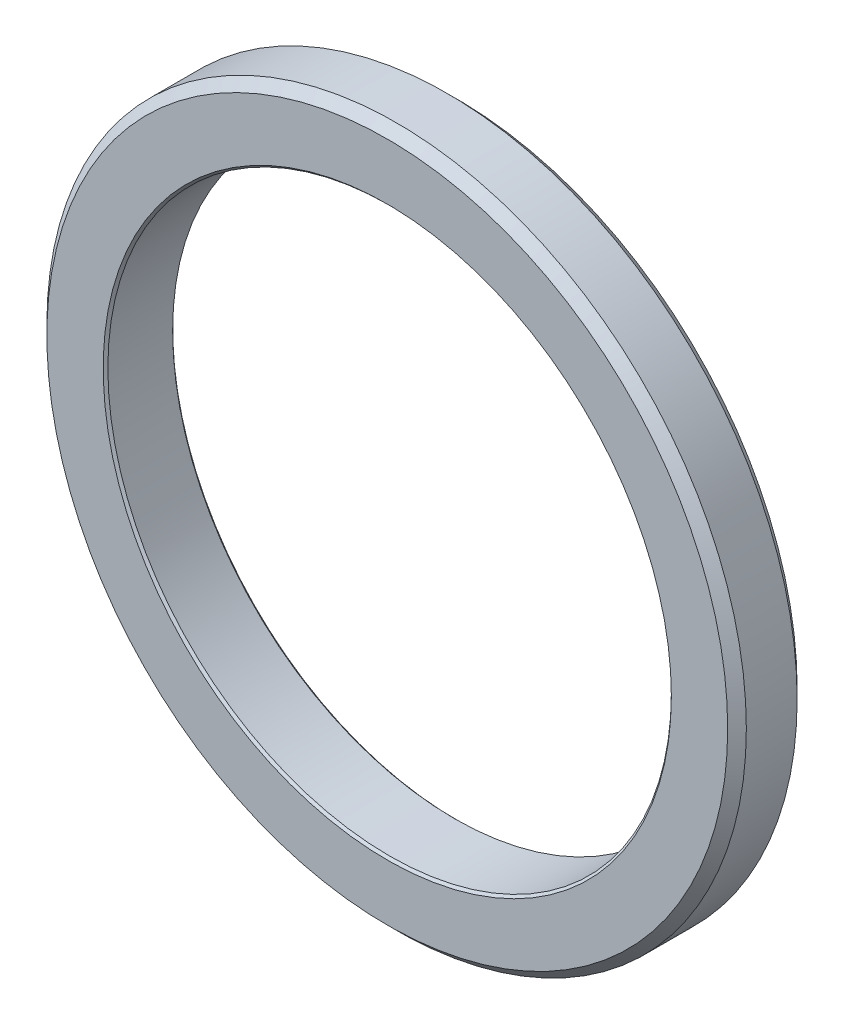
from build123d import *


with BuildPart() as part:
    # Sketch1 → Revolve1 (revolve)
    with BuildSketch(Plane(origin=(0, 0, 0), x_dir=(0, 0, -1), z_dir=(1, 0, 0)), mode=Mode.PRIVATE) as revolve1_sk:
        Polygon((0, 30.475), (0.25, 30.225), (7.2, 30.225), (7.45, 30.475), (7.45, 36.5195), (6.45, 37.5195), (1, 37.5195), (0, 36.5195), align=None)
    revolve(revolve1_sk.sketch.rotate(Axis((0, 0, 0), (0, 0, -1)), 90), axis=Axis((0, 0, 0), (0, 0, -1)))


solid = part.part
